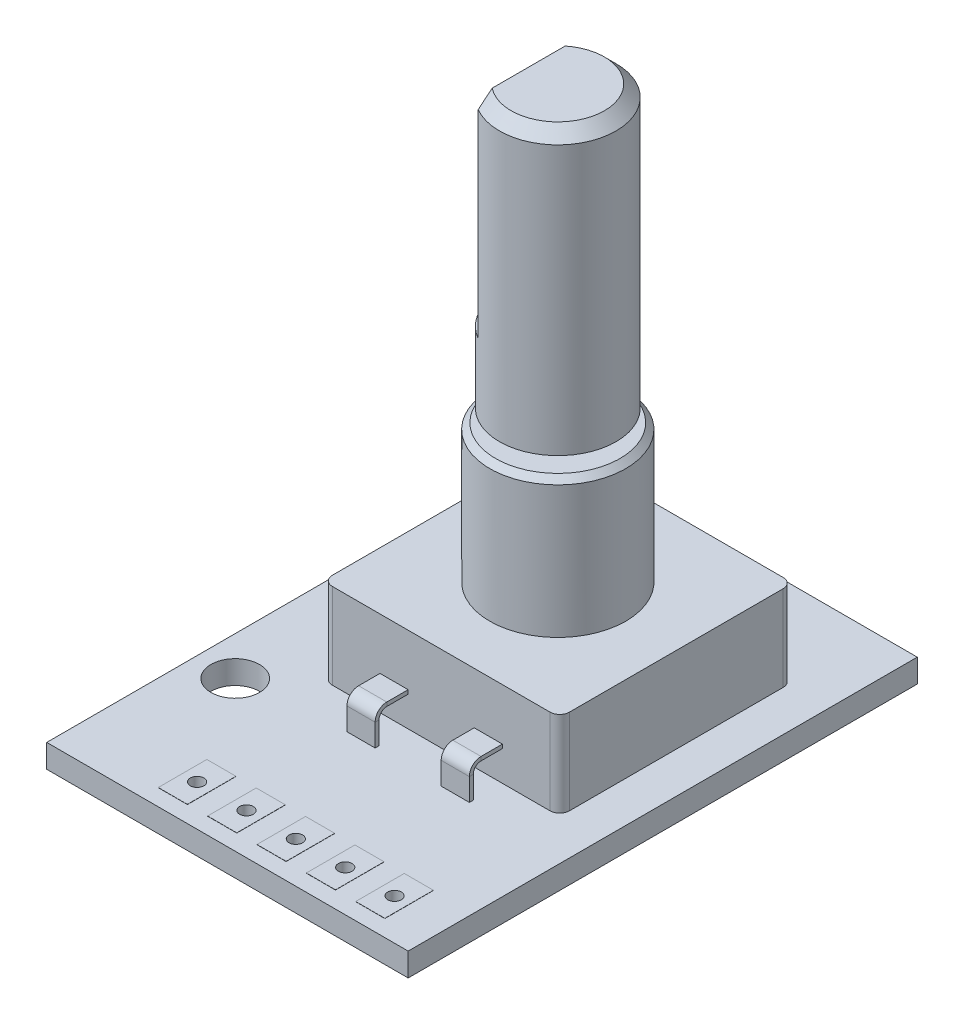
from build123d import *

# Parameters (mm, degrees)
SKETCH1_W           = 18.6
SKETCH1_H           = 26.2
SKETCH1_R           = 1.25
BOSS_EXTRUDE1_DEPTH = 1.2
SKETCH3_W           = 12.2
SKETCH3_H           = 12
BOSS_EXTRUDE2_DEPTH = 4.4
SKETCH10_W          = 1.45
SKETCH10_H          = 0.2
SKETCH13_W          = 1.45
SKETCH13_H          = 0.2
LPATTERN1_COUNT     = 2
LPATTERN1_PITCH     = 2.85
LPATTERN2_COUNT     = 2
LPATTERN2_PITCH     = 2.85
SKETCH14_R          = 3.5
BOSS_EXTRUDE4_DEPTH = 7.1
CHAMFER1_SIZE       = 0.3
SKETCH15_R          = 1.9
BOSS_EXTRUDE5_DEPTH = 0.65
SKETCH16_R          = 3
BOSS_EXTRUDE6_DEPTH = 14.45
CHAMFER2_SIZE       = 0.6
CUT_EXTRUDE1_START  = -10.8
CUT_EXTRUDE1_DEPTH  = 10.8
SKETCH18_R          = 0.35
CUT_EXTRUDE2_DEPTH  = 1.2
BOSS_EXTRUDE7_START = 0.01
SKETCH19_W          = 1.5
SKETCH19_H          = 2.5
SKETCH19_R          = 0.35
BOSS_EXTRUDE7_DEPTH = 0.01
FILLET1_R           = 0.5


with BuildPart() as part:
    # Sketch1 → Boss-Extrude1 (new body)
    with BuildSketch(Plane(origin=(0, 0, 0), x_dir=(1, 0, 0), z_dir=(0, 1, 0))):
        Rectangle(SKETCH1_W, SKETCH1_H)
        with Locations(Location((-7.3, 8.3, 0), (0, 0, 270))):
            Circle(SKETCH1_R, mode=Mode.SUBTRACT)
        with Locations(Location((-7.3, -5.4, 0), (0, 0, 270))):
            Circle(SKETCH1_R, mode=Mode.SUBTRACT)
    extrude(amount=BOSS_EXTRUDE1_DEPTH)

    # Sketch3 → Boss-Extrude2 (add)
    with BuildSketch(Plane(origin=(0, 1.2, 0), x_dir=(1, 0, 0), z_dir=(0, 1, 0))):
        with Locations((1.1, 2.8)):
            Rectangle(SKETCH3_W, SKETCH3_H)
    extrude(amount=BOSS_EXTRUDE2_DEPTH)

    # Sweep3: sweep along a curve in space
    with BuildLine() as sweep3_path:
        Line((-1.325, 2.85, 3.2), (-1.325, 2.85, 4.3))
        ThreePointArc((-1.325, 2.85, 4.3), (-1.325, 2.703553391, 4.653553391), (-1.325, 2.35, 4.8))
        Line((-1.325, 2.35, 4.8), (-1.325, 1.2, 4.8))
    # Sketch10 → Sweep3 (sweep)
    with BuildSketch(Plane.XY.offset(3.2)):
        with Locations((-1.325, 2.85)):
            Rectangle(SKETCH10_W, SKETCH10_H)
    sweep3 = sweep(path=sweep3_path.line)

    # Mirror2: Sweep3 across plane
    add(sweep3.mirror(Plane.ZY.offset(-1.1)))

    # Sweep4: sweep along a curve in space
    with BuildLine() as sweep4_path:
        Line((1.1, 2.8, -8.8), (1.1, 2.8, -9.75))
        ThreePointArc((1.1, 2.8, -9.75), (1.1, 2.653553391, -10.103553391), (1.1, 2.3, -10.25))
        Line((1.1, 2.3, -10.25), (1.1, 1.2, -10.25))
    # Sketch13 → Sweep4 (sweep)
    with BuildSketch(Plane(origin=(0, 0, -8.8), x_dir=(-1, 0, 0), z_dir=(0, 0, -1))):
        with Locations((-1.1, 2.8)):
            Rectangle(SKETCH13_W, SKETCH13_H)
    sweep4 = sweep(path=sweep4_path.line)

    # LPattern1: Sweep4 ×2
    with Locations(*[(-i * LPATTERN1_PITCH, 0, 0) for i in range(1, LPATTERN1_COUNT)]):
        add(sweep4)

    # LPattern2: Sweep4 ×2
    with Locations(*[(i * LPATTERN2_PITCH, 0, 0) for i in range(1, LPATTERN2_COUNT)]):
        add(sweep4)

    # Sketch14 → Boss-Extrude4 (add)
    with BuildSketch(Plane(origin=(0, 5.6, 0), x_dir=(1, 0, 0), z_dir=(0, 1, 0))):
        with Locations(Location((1.1, 2.8, 0), (0, 0, 270))):
            Circle(SKETCH14_R)
    extrude(amount=BOSS_EXTRUDE4_DEPTH)

    # Chamfer1
    chamfer1_edges = [part.edges().sort_by_distance(p)[0] for p in [
        (1.1, 12.7, -6.3),
    ]]
    chamfer(chamfer1_edges, length=CHAMFER1_SIZE)

    # Sketch15 → Boss-Extrude5 (add)
    with BuildSketch(Plane(origin=(0, 12.7, 0), x_dir=(1, 0, 0), z_dir=(0, 1, 0))):
        with Locations(Location((1.1, 2.8, 0), (0, 0, 270))):
            Circle(SKETCH15_R)
    extrude(amount=BOSS_EXTRUDE5_DEPTH)

    # Sketch16 → Boss-Extrude6 (add)
    with BuildSketch(Plane(origin=(0, 13.35, 0), x_dir=(1, 0, 0), z_dir=(0, 1, 0))):
        with Locations(Location((1.1, 2.8, 0), (0, 0, 270))):
            Circle(SKETCH16_R)
    extrude(amount=BOSS_EXTRUDE6_DEPTH)

    # Chamfer2
    chamfer2_edges = [part.edges().sort_by_distance(p)[0] for p in [
        (1.1, 27.8, -5.8),
    ]]
    chamfer(chamfer2_edges, length=CHAMFER2_SIZE)

    # Sketch17 → Cut-Extrude1 (cut)
    with BuildSketch(Plane(origin=(0, 27.8, 0), x_dir=(1, 0, 0), z_dir=(0, 1, 0)).offset(CUT_EXTRUDE1_START)):
        with BuildLine():
            Line((-0.396662955, 5.4), (-0.396662955, 0.2))
            ThreePointArc((-0.396662955, 0.2), (-1.9, 2.8), (-0.396662955, 5.4))
        make_face()
    extrude(amount=CUT_EXTRUDE1_DEPTH, mode=Mode.SUBTRACT)

    # Sketch18 → Cut-Extrude2 (cut)
    with BuildSketch(Plane(origin=(0, 1.2, 0), x_dir=(1, 0, 0), z_dir=(0, 1, 0))):
        with Locations(Location((6.5, -11, 0), (0, 0, 270))):
            Circle(SKETCH18_R)
        with Locations(Location((3.96, -11, 0), (0, 0, 270))):
            Circle(SKETCH18_R)
        with Locations(Location((1.42, -11, 0), (0, 0, 270))):
            Circle(SKETCH18_R)
        with Locations(Location((-1.12, -11, 0), (0, 0, 270))):
            Circle(SKETCH18_R)
        with Locations(Location((-3.66, -11, 0), (0, 0, 270))):
            Circle(SKETCH18_R)
    extrude(amount=-CUT_EXTRUDE2_DEPTH, mode=Mode.SUBTRACT)

    # Sketch19 → Boss-Extrude7 (add)
    # profile 1 of 5: a face of its own
    with BuildSketch(Plane(origin=(0, 1.2, 0), x_dir=(1, 0, 0), z_dir=(0, 1, 0)).offset(BOSS_EXTRUDE7_START)):
        with Locations((3.96, -11)):
            Rectangle(SKETCH19_W, SKETCH19_H)
        with Locations(Location((3.96, -11, 0), (0, 0, 270))):
            Circle(SKETCH19_R, mode=Mode.SUBTRACT)
    # profile 2 of 5: a face of its own
    with BuildSketch(Plane(origin=(0, 1.2, 0), x_dir=(1, 0, 0), z_dir=(0, 1, 0)).offset(BOSS_EXTRUDE7_START)):
        with Locations((6.5, -11)):
            Rectangle(SKETCH19_W, SKETCH19_H)
        with Locations(Location((6.5, -11, 0), (0, 0, 270))):
            Circle(SKETCH19_R, mode=Mode.SUBTRACT)
    # profile 3 of 5: a face of its own
    with BuildSketch(Plane(origin=(0, 1.2, 0), x_dir=(1, 0, 0), z_dir=(0, 1, 0)).offset(BOSS_EXTRUDE7_START)):
        with Locations((1.42, -11)):
            Rectangle(SKETCH19_W, SKETCH19_H)
        with Locations(Location((1.42, -11, 0), (0, 0, 270))):
            Circle(SKETCH19_R, mode=Mode.SUBTRACT)
    # profile 4 of 5: a face of its own
    with BuildSketch(Plane(origin=(0, 1.2, 0), x_dir=(1, 0, 0), z_dir=(0, 1, 0)).offset(BOSS_EXTRUDE7_START)):
        with Locations((-1.12, -11)):
            Rectangle(SKETCH19_W, SKETCH19_H)
        with Locations(Location((-1.12, -11, 0), (0, 0, 270))):
            Circle(SKETCH19_R, mode=Mode.SUBTRACT)
    # profile 5 of 5: a face of its own
    with BuildSketch(Plane(origin=(0, 1.2, 0), x_dir=(1, 0, 0), z_dir=(0, 1, 0)).offset(BOSS_EXTRUDE7_START)):
        with Locations((-3.66, -11)):
            Rectangle(SKETCH19_W, SKETCH19_H)
        with Locations(Location((-3.66, -11, 0), (0, 0, 270))):
            Circle(SKETCH19_R, mode=Mode.SUBTRACT)
    boss_extrude7 = extrude(amount=-BOSS_EXTRUDE7_DEPTH)

    # Mirror3: Boss-Extrude7 across plane
    add(boss_extrude7.mirror(Plane.ZX.offset(0.6)))

    # Fillet1
    fillet1_edges = [part.edges().sort_by_distance(p)[0] for p in [
        (7.2, 3.4, 3.2),
        (7.2, 3.4, -8.8),
        (-5, 3.4, -8.8),
        (-5, 3.4, 3.2),
    ]]
    fillet(fillet1_edges, radius=FILLET1_R)


solid = part.part
